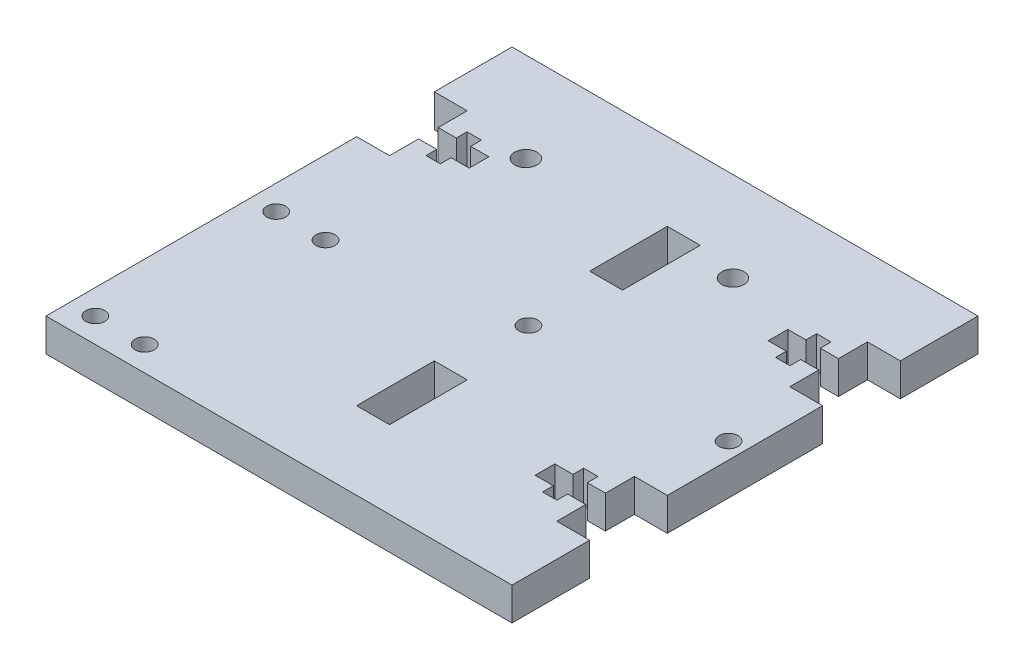
from build123d import *

# Parameters (mm, degrees)
SKETCH1_W             = 90
SKETCH1_H             = 90
BOSS_EXTRUDE1_DEPTH   = 6.35
F_6_CLEARANCE_HOLE1_D = 3.6576
LPATTERN1_COUNT       = 2
LPATTERN1_PITCH       = 34.925
LPATTERN1_COUNT_DIR2  = 2
LPATTERN1_PITCH_DIR2  = 9.525
F_8_CLEARANCE_HOLE1_D = 4.3053
SKETCH7_W             = 6.35
SKETCH7_H             = 15
CUT_EXTRUDE1_DEPTH    = 64.95562915
F_6_CLEARANCE_HOLE2_D = 3.6576
CUT_EXTRUDE2_DEPTH    = 64.95562915
CUT_EXTRUDE3_DEPTH    = 64.95562915


with BuildPart() as part:
    # Sketch1 → Boss-Extrude1 (new body)
    with BuildSketch(Plane(origin=(0, 0, 0), x_dir=(1, 0, 0), z_dir=(0, 1, 0))):
        Rectangle(SKETCH1_W, SKETCH1_H)
    extrude(amount=BOSS_EXTRUDE1_DEPTH)

    # #6 Clearance Hole1 (through all)
    with Locations(Plane(origin=(0, 6.35, 0), x_dir=(1, 0, 0), z_dir=(0, 1, 0))):
        with Locations((-40.2375, -40.2375)):
            f_6_clearance_hole1 = Hole(F_6_CLEARANCE_HOLE1_D / 2)

    # LPattern1: 6 Clearance Hole1 2 × 2
    with Locations(*[(j * LPATTERN1_PITCH_DIR2, 0, -i * LPATTERN1_PITCH) for i in range(LPATTERN1_COUNT) for j in range(LPATTERN1_COUNT_DIR2) if (i, j) != (0, 0)]):
        add(f_6_clearance_hole1, mode=Mode.SUBTRACT)

    # #8 Clearance Hole1 (through all)
    with Locations(Plane(origin=(0, 6.35, 0), x_dir=(1, 0, 0), z_dir=(0, 1, 0))):
        with Locations((-25, 27.675), (15, 27.675)):
            Hole(F_8_CLEARANCE_HOLE1_D / 2)

    # Sketch7 → Cut-Extrude1 (cut, through all)
    with BuildSketch(Plane(origin=(0, 6.35, 0), x_dir=(1, 0, 0), z_dir=(0, 1, 0))):
        with Locations((3.175, -22.5)):
            Rectangle(SKETCH7_W, SKETCH7_H)
        with Locations((3.175, 22.5)):
            Rectangle(SKETCH7_W, SKETCH7_H)
        with Locations((41.825, -22.5)):
            Rectangle(SKETCH7_W, SKETCH7_H)
        with Locations((41.825, 22.5)):
            Rectangle(SKETCH7_W, SKETCH7_H)
    extrude(amount=-CUT_EXTRUDE1_DEPTH, mode=Mode.SUBTRACT)

    # #6 Clearance Hole2 (through all)
    with Locations(Plane(origin=(0, 6.35, 0), x_dir=(1, 0, 0), z_dir=(0, 1, 0))):
        with Locations((41.825, 0), (3.175, 0)):
            Hole(F_6_CLEARANCE_HOLE2_D / 2)

    # Sketch10 → Cut-Extrude2 (cut, through all)
    with BuildSketch(Plane(origin=(0, 6.35, 0), x_dir=(1, 0, 0), z_dir=(0, 1, 0))):
        Polygon((28.871, -20.60135), (28.871, -24.39865), (32.3714375, -24.39865), (32.3714375, -26.46875), (35.1495625, -26.46875), (35.1495625, -24.39865), (38.65, -24.39865), (38.65, -20.60135), (35.1495625, -20.60135), (35.1495625, -18.53125), (32.3714375, -18.53125), (32.3714375, -20.60135), align=None)
        Polygon((38.65, 24.39865), (38.65, 20.60135), (35.1495625, 20.60135), (35.1495625, 18.53125), (32.3714375, 18.53125), (32.3714375, 20.60135), (28.871, 20.60135), (28.871, 24.39865), (32.3714375, 24.39865), (32.3714375, 26.46875), (35.1495625, 26.46875), (35.1495625, 24.39865), align=None)
    extrude(amount=-CUT_EXTRUDE2_DEPTH, mode=Mode.SUBTRACT)

    # Sketch11 → Cut-Extrude3 (cut, through all)
    with BuildSketch(Plane(origin=(0, 6.35, 0), x_dir=(1, 0, 0), z_dir=(0, 1, 0))):
        Polygon((-45, 15), (-38.65, 15), (-38.65, 20.60135), (-35.1495625, 20.60135), (-35.1495625, 18.53125), (-32.3714375, 18.53125), (-32.3714375, 20.60135), (-28.871, 20.60135), (-28.871, 24.39865), (-32.3714375, 24.39865), (-32.3714375, 26.46875), (-35.1495625, 26.46875), (-35.1495625, 24.39865), (-38.65, 24.39865), (-38.65, 30), (-45, 30), align=None)
    extrude(amount=-CUT_EXTRUDE3_DEPTH, mode=Mode.SUBTRACT)


solid = part.part
